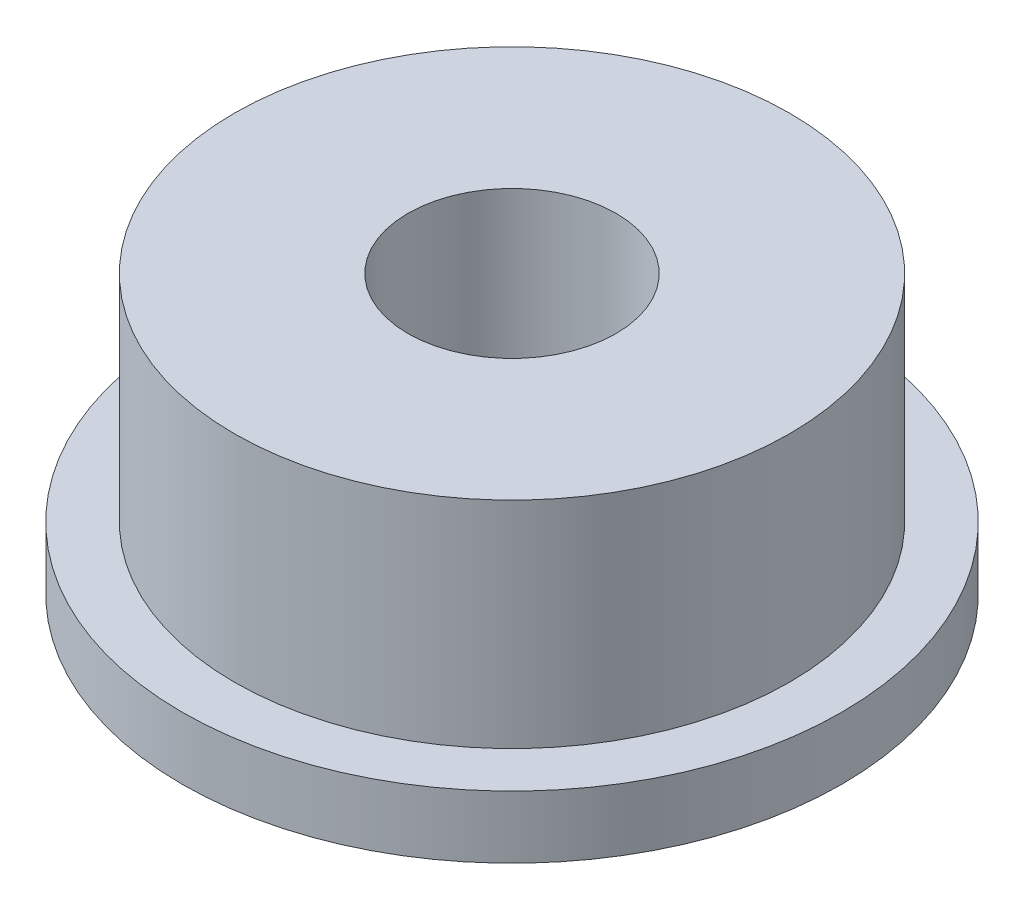
from build123d import *


with BuildPart() as part:
    # Sketch1 → Revolve1 (revolve)
    with BuildSketch(Plane.XY, mode=Mode.PRIVATE) as revolve1_sk:
        Polygon((1.5, 0), (4.75, 0), (4.75, 0.9), (4, 0.9), (4, 4), (1.5, 4), align=None)
    revolve(revolve1_sk.sketch.rotate(Axis((0, 4, 0), (0, -1, 0)), 90), axis=Axis((0, 4, 0), (0, -1, 0)))


solid = part.part
